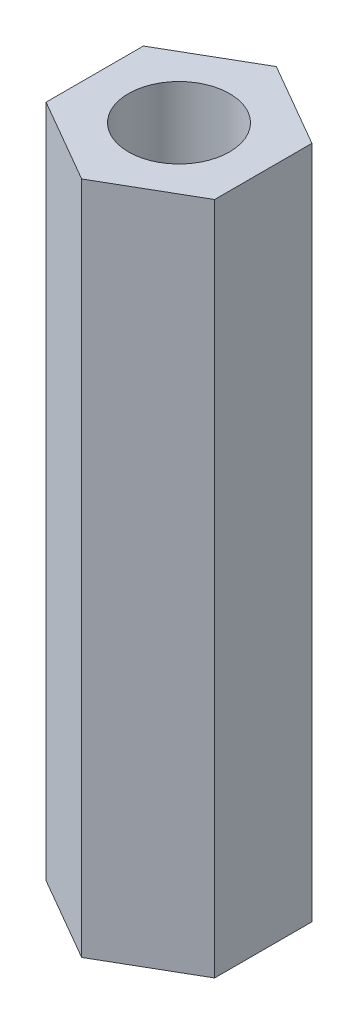
from build123d import *

# Parameters (mm, degrees)
SKETCH1_R           = 1.5
BOSS_EXTRUDE1_DEPTH = 20


with BuildPart() as part:
    # Sketch1 → Boss-Extrude1 (new body)
    with BuildSketch(Plane(origin=(0, 0, 0), x_dir=(1, 0, 0), z_dir=(0, 1, 0))):
        Polygon((0, -2.886751346), (2.5, -1.443375673), (2.5, 1.443375673), (0, 2.886751346), (-2.5, 1.443375673), (-2.5, -1.443375673), align=None)
        with Locations(Location((0, 0, 0), (0, 0, 270))):
            Circle(SKETCH1_R, mode=Mode.SUBTRACT)
    extrude(amount=BOSS_EXTRUDE1_DEPTH)


solid = part.part
